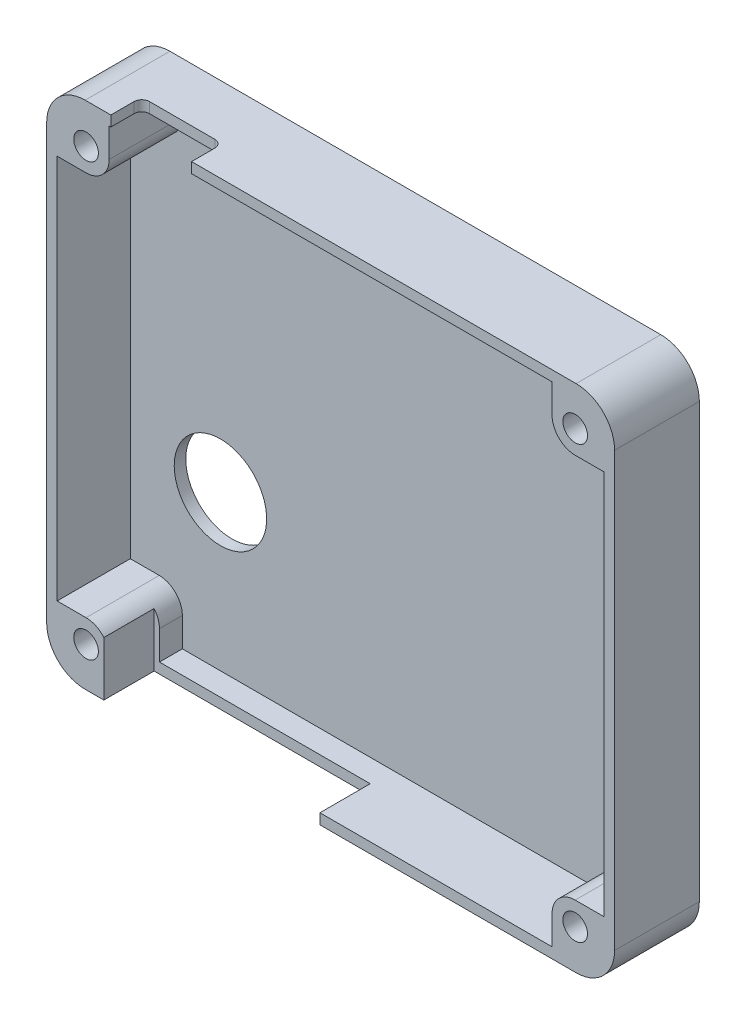
from build123d import *

# Parameters (mm, degrees)
SKETCH_1_W               = 73.73
SKETCH_1_H               = 66.24
EXTRUDE_1_DEPTH          = 11
CUT_EXTRUDE_1_DEPTH      = 14
CUT_EXTRUDE_1_DEPTH_BACK = 100.723871265
SKETCH_5_R               = 1.6
CUT_EXTRUDE_2_DEPTH      = 9.5
SKETCH_8_R               = 0.5
SKETCH_8_R_2             = 0.499999992
SKETCH_8_R_3             = 2.25
SKETCH_8_R_4             = 6
CUT_EXTRUDE_3_DEPTH      = 9
CUT_EXTRUDE_4_DEPTH      = 9
SKETCH_11_W              = 28.050882838
SKETCH_11_H              = 6.729999604
CUT_EXTRUDE_5_DEPTH      = 9
FILLET_1_R               = 5


with BuildPart() as part:
    # 草图1 → 凸台-拉伸1 (new body)
    with BuildSketch(Plane.XY):
        with Locations((36.865, 33.12)):
            Rectangle(SKETCH_1_W, SKETCH_1_H)
    extrude(amount=EXTRUDE_1_DEPTH)

    # 草图5 → 切除-拉伸1 (cut, two sides: drawn at the far end of the back side and taken through both)
    with BuildSketch(Plane.XY.offset(-CUT_EXTRUDE_1_DEPTH_BACK)):
        with Locations(Location((5.115, 61.125, 0), (0, 0, 180))):
            Circle(SKETCH_5_R)
        with Locations(Location((68.615, 61.125, 0), (0, 0, 180))):
            Circle(SKETCH_5_R)
        with Locations(Location((68.615, 5.115, 0), (0, 0, 180))):
            Circle(SKETCH_5_R)
        with Locations(Location((5.115, 5.115, 0), (0, 0, 180))):
            Circle(SKETCH_5_R)
    extrude(amount=CUT_EXTRUDE_1_DEPTH + CUT_EXTRUDE_1_DEPTH_BACK, mode=Mode.SUBTRACT)

    # 草图6 → 切除-拉伸2 (cut)
    with BuildSketch(Plane.XY.offset(11)):
        with BuildLine():
            Line((1.36, 58.125), (1.36, 8.115))
            Line((1.36, 8.115), (5.115, 8.115))
            ThreePointArc((5.115, 8.115), (7.236320344, 7.236320344), (8.115, 5.115))
            Line((8.115, 5.115), (8.115, 1.36))
            Line((8.115, 1.36), (65.615, 1.36))
            Line((65.615, 1.36), (65.615, 5.115))
            ThreePointArc((65.615, 5.115), (66.493679656, 7.236320344), (68.615, 8.115))
            Line((68.615, 8.115), (72.37, 8.115))
            Line((72.37, 8.115), (72.37, 58.125))
            Line((72.37, 58.125), (68.615, 58.125))
            ThreePointArc((68.615, 58.125), (66.493679656, 59.003679656), (65.615, 61.125))
            Line((65.615, 61.125), (65.615, 64.88))
            Line((65.615, 64.88), (8.115, 64.88))
            Line((8.115, 64.88), (8.115, 61.125))
            ThreePointArc((8.115, 61.125), (7.236320344, 59.003679656), (5.115, 58.125))
            Line((5.115, 58.125), (1.36, 58.125))
        make_face()
    extrude(amount=-CUT_EXTRUDE_2_DEPTH, mode=Mode.SUBTRACT)

    # 草图8 → 切除-拉伸3 (cut)
    with BuildSketch(Plane.XY):
        with Locations(Location((62.581524864, 61.690056586, 0), (0, 0, 180))):
            Circle(SKETCH_8_R)
        with Locations(Location((60.543023731, 61.690056586, 0), (0, 0, 180))):
            Circle(SKETCH_8_R_2)
        with Locations(Location((64.607021964, 61.690056586, 0), (0, 0, 180))):
            Circle(SKETCH_8_R)
        with Locations(Location((54.862855038, 58.701240743, 0), (0, 0, 180))):
            Circle(SKETCH_8_R_3)
        with Locations(Location((49.528855397, 58.701240743, 0), (0, 0, 180))):
            Circle(SKETCH_8_R_3)
        with Locations(Location((40.365063963, 61.690056586, 0), (0, 0, 180))):
            Circle(SKETCH_8_R)
        with Locations(Location((13.058538298, 21.432969982, 0), (0, 0, 180))):
            Circle(SKETCH_8_R_4)
    extrude(amount=CUT_EXTRUDE_3_DEPTH, mode=Mode.SUBTRACT)

    # 草图10 → 切除-拉伸4 (cut)
    with BuildSketch(Plane(origin=(0, 66.24, 0), x_dir=(1, 0, 0), z_dir=(0, 1, 0))):
        with BuildLine():
            Line((17.808167787, -6.98156116), (9.328167793, -6.98156116))
            ThreePointArc((9.328167793, -6.98156116), (8.621061012, -7.274454379), (8.328167793, -7.98156116))
            Line((8.328167793, -7.98156116), (8.328167793, -11))
            Line((8.328167793, -11), (18.808167787, -11))
            Line((18.808167787, -11), (18.808167787, -7.98156116))
            ThreePointArc((18.808167787, -7.98156116), (18.515274569, -7.274454379), (17.808167787, -6.98156116))
        make_face()
    extrude(amount=-CUT_EXTRUDE_4_DEPTH, mode=Mode.SUBTRACT)

    # 草图11 → 切除-拉伸5 (cut)
    with BuildSketch(Plane.XZ):
        with Locations((21.447326516, 7.836561358)):
            Rectangle(SKETCH_11_W, SKETCH_11_H)
    extrude(amount=-CUT_EXTRUDE_5_DEPTH, mode=Mode.SUBTRACT)

    # 圆角1
    fillet_1_edges = [part.edges().sort_by_distance(p)[0] for p in [
        (0, 66.24, 5.5),
        (73.73, 66.24, 5.5),
        (73.73, 0, 5.5),
        (0, 0, 5.5),
    ]]
    fillet(fillet_1_edges, radius=FILLET_1_R)


solid = part.part
